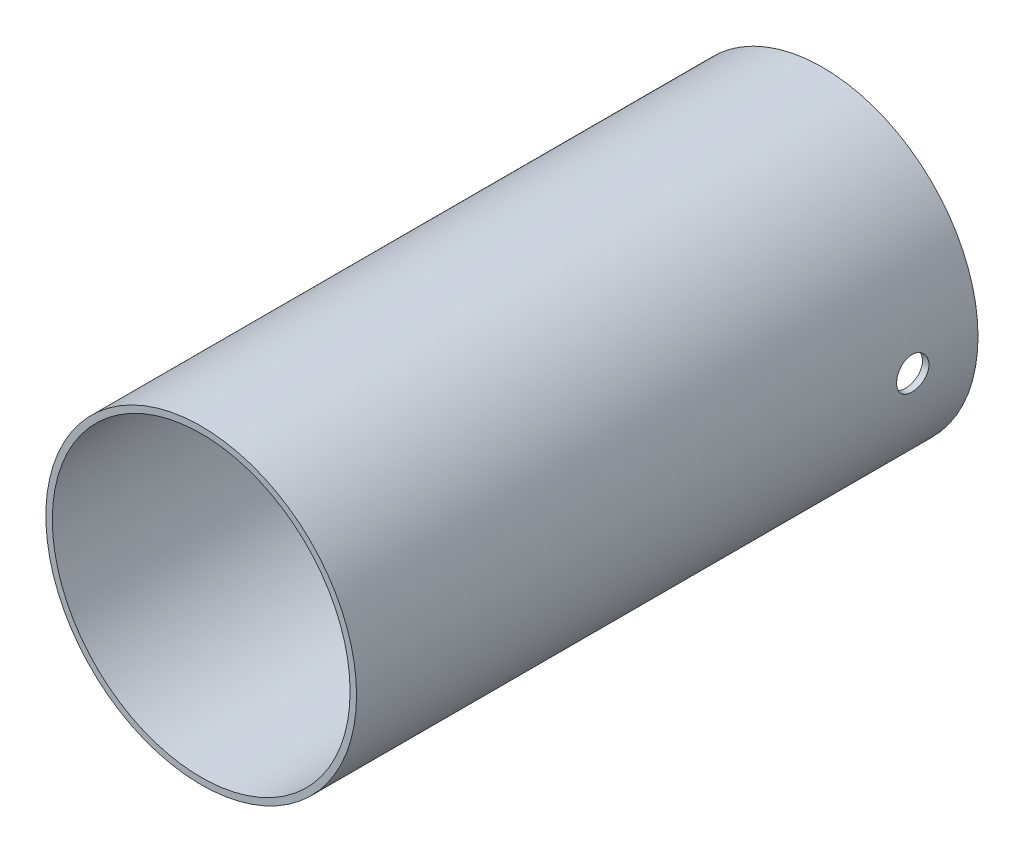
from build123d import *

# Parameters (mm, degrees)
SKETCH3_R                      = 38.1
SKETCH3_R_2                    = 36.5125
BOSS_EXTRUDE1_DEPTH            = 152.4
F_5_16_0_3125_DIAMETER_HOLE1_D = 7.9375


with BuildPart() as part:
    # Sketch3 → Boss-Extrude1 (new body)
    with BuildSketch(Plane.XY):
        with Locations(Location((0, 0, 0), (0, 0, 180))):
            Circle(SKETCH3_R)
        with Locations(Location((0, 0, 0), (0, 0, 180))):
            Circle(SKETCH3_R_2, mode=Mode.SUBTRACT)
    extrude(amount=BOSS_EXTRUDE1_DEPTH)

    # 5/16 (0.3125) Diameter Hole1 (through all)
    with Locations(Plane(origin=(-38.099976396, -0.042410423, 15.997241371), x_dir=(0.00111313445, -0.999999380466, 0), z_dir=(-0.999999380466, -0.00111313445, 0))):
        with Locations((0, 0)):
            Hole(F_5_16_0_3125_DIAMETER_HOLE1_D / 2)


solid = part.part
